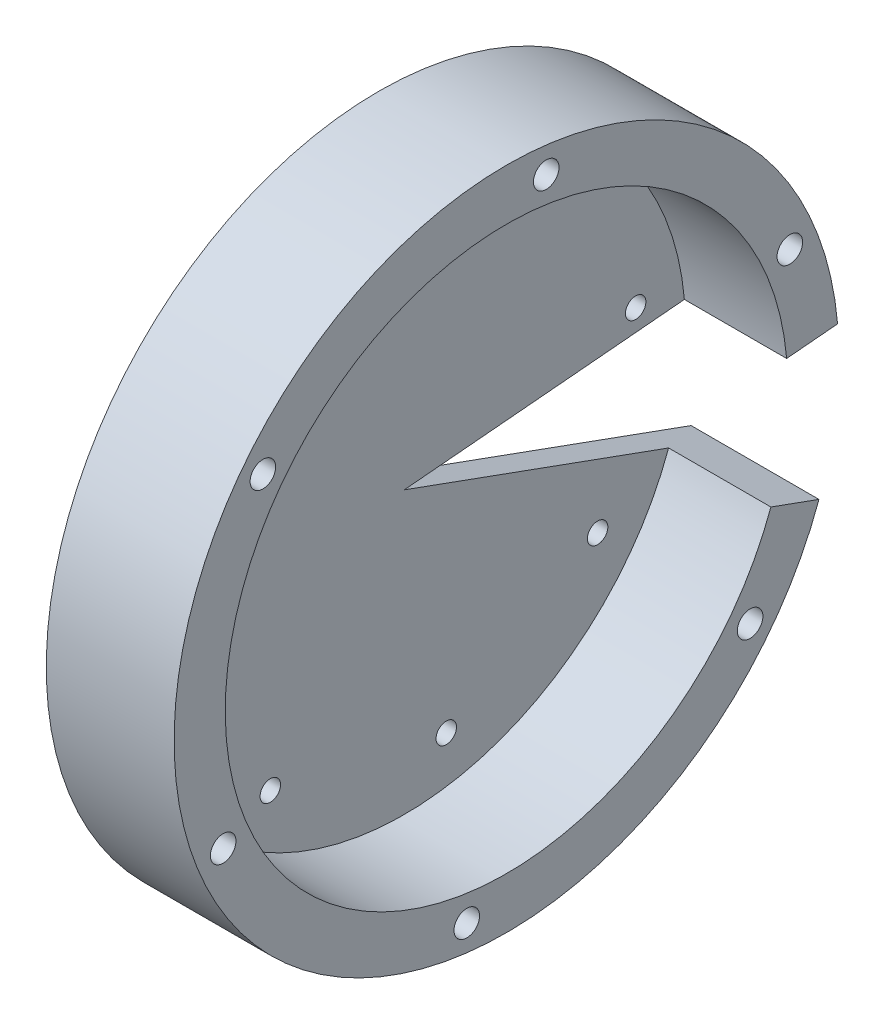
from build123d import *

# Parameters (mm, degrees)
SKETCH_1_R          = 55
EXTRUDE_1_DEPTH     = 5
SKETCH_2_R          = 65
SKETCH_2_R_2        = 60
SKETCH_2_R_3        = 55
EXTRUDE_2_DEPTH     = 25
SKETCH_3_R          = 2.5
CUT_EXTRUDE_1_DEPTH = 96.262794416
SKETCH_4_R          = 4
SKETCH_4_R_2        = 2.5
CUT_EXTRUDE_2_DEPTH = 10
CUT_EXTRUDE_3_REACH = 97.263
SKETCH_5_R          = 2
SKETCH_6_R          = 2.5
CUT_EXTRUDE_4_DEPTH = 2
CUT_EXTRUDE_5_DEPTH = 96.262794416


with BuildPart() as part:
    # 草图1 → 凸台-拉伸1 (new body)
    with BuildSketch(Plane(origin=(0, 0, 0), x_dir=(0, 0, -1), z_dir=(1, 0, 0))):
        Circle(SKETCH_1_R)
    extrude(amount=EXTRUDE_1_DEPTH)

    # 草图2 → 凸台-拉伸2 (add)
    # profile 1 of 2: a face of its own
    with BuildSketch(Plane.ZY):
        Circle(SKETCH_2_R)
        Circle(SKETCH_2_R_2, mode=Mode.SUBTRACT)
    # profile 2 of 2: a face of its own
    with BuildSketch(Plane.ZY):
        Circle(SKETCH_2_R_2)
        Circle(SKETCH_2_R_3, mode=Mode.SUBTRACT)
    extrude(amount=-EXTRUDE_2_DEPTH)

    # 草图3 → 切除-拉伸1 (cut, through all)
    with BuildSketch(Plane.ZY):
        with Locations((-7.767898365, 59.495039751)):
            Circle(SKETCH_3_R)
        with Locations((47.640266641, 36.474717194)):
            Circle(SKETCH_3_R)
        with Locations((55.408165006, -23.020322557)):
            Circle(SKETCH_3_R)
        with Locations((7.767898365, -59.495039751)):
            Circle(SKETCH_3_R)
        with Locations((-47.640266641, -36.474717194)):
            Circle(SKETCH_3_R)
        with Locations((-55.408165006, 23.020322557)):
            Circle(SKETCH_3_R)
    extrude(amount=-CUT_EXTRUDE_1_DEPTH, mode=Mode.SUBTRACT)

    # 草图4 → 切除-拉伸2 (cut)
    # profile 1 of 6: a face of its own
    with BuildSketch(Plane.ZY):
        with Locations((55.408165006, -23.020322557)):
            Circle(SKETCH_4_R)
        with Locations((55.408165006, -23.020322557)):
            Circle(SKETCH_4_R_2, mode=Mode.SUBTRACT)
    # profile 2 of 6: a face of its own
    with BuildSketch(Plane.ZY):
        with Locations((47.640266641, 36.474717194)):
            Circle(SKETCH_4_R)
        with Locations((47.640266641, 36.474717194)):
            Circle(SKETCH_4_R_2, mode=Mode.SUBTRACT)
    # profile 3 of 6: a face of its own
    with BuildSketch(Plane.ZY):
        with Locations((-7.767898365, 59.495039751)):
            Circle(SKETCH_4_R)
        with Locations((-7.767898365, 59.495039751)):
            Circle(SKETCH_4_R_2, mode=Mode.SUBTRACT)
    # profile 4 of 6: a face of its own
    with BuildSketch(Plane.ZY):
        with Locations((-55.408165006, 23.020322557)):
            Circle(SKETCH_4_R)
        with Locations((-55.408165006, 23.020322557)):
            Circle(SKETCH_4_R_2, mode=Mode.SUBTRACT)
    # profile 5 of 6: a face of its own
    with BuildSketch(Plane.ZY):
        with Locations((-47.640266641, -36.474717194)):
            Circle(SKETCH_4_R)
        with Locations((-47.640266641, -36.474717194)):
            Circle(SKETCH_4_R_2, mode=Mode.SUBTRACT)
    # profile 6 of 6: a face of its own
    with BuildSketch(Plane.ZY):
        with Locations((7.767898365, -59.495039751)):
            Circle(SKETCH_4_R)
    extrude(amount=-CUT_EXTRUDE_2_DEPTH, mode=Mode.SUBTRACT)

    # 草图5 → 切除-拉伸3 (cut, up to next)
    with BuildSketch(Plane.ZY, mode=Mode.PRIVATE) as cut_extrude_3_sk1:
        with Locations((-26.187421569, 37.818235702)):
            Circle(SKETCH_5_R)
    cut_extrude_3_tool1 = extrude(cut_extrude_3_sk1.sketch, amount=-CUT_EXTRUDE_3_REACH, mode=Mode.PRIVATE) & part.part
    # 草图5 → 切除-拉伸3 (cut, up to next)
    with BuildSketch(Plane.ZY, mode=Mode.PRIVATE) as cut_extrude_3_sk2:
        with Locations((8.224227544, 45.25883429)):
            Circle(SKETCH_5_R)
    cut_extrude_3_tool2 = extrude(cut_extrude_3_sk2.sketch, amount=-CUT_EXTRUDE_3_REACH, mode=Mode.PRIVATE) & part.part
    # 草图5 → 切除-拉伸3 (cut, up to next)
    with BuildSketch(Plane.ZY, mode=Mode.PRIVATE) as cut_extrude_3_sk3:
        with Locations((37.818235702, 26.187421569)):
            Circle(SKETCH_5_R)
    cut_extrude_3_tool3 = extrude(cut_extrude_3_sk3.sketch, amount=-CUT_EXTRUDE_3_REACH, mode=Mode.PRIVATE) & part.part
    # 草图5 → 切除-拉伸3 (cut, up to next)
    with BuildSketch(Plane.ZY, mode=Mode.PRIVATE) as cut_extrude_3_sk4:
        with Locations((45.25883429, -8.224227544)):
            Circle(SKETCH_5_R)
    cut_extrude_3_tool4 = extrude(cut_extrude_3_sk4.sketch, amount=-CUT_EXTRUDE_3_REACH, mode=Mode.PRIVATE) & part.part
    # 草图5 → 切除-拉伸3 (cut, up to next)
    with BuildSketch(Plane.ZY, mode=Mode.PRIVATE) as cut_extrude_3_sk5:
        with Locations((26.187421569, -37.818235702)):
            Circle(SKETCH_5_R)
    cut_extrude_3_tool5 = extrude(cut_extrude_3_sk5.sketch, amount=-CUT_EXTRUDE_3_REACH, mode=Mode.PRIVATE) & part.part
    # 草图5 → 切除-拉伸3 (cut, up to next)
    with BuildSketch(Plane.ZY, mode=Mode.PRIVATE) as cut_extrude_3_sk6:
        with Locations((-8.224227544, -45.25883429)):
            Circle(SKETCH_5_R)
    cut_extrude_3_tool6 = extrude(cut_extrude_3_sk6.sketch, amount=-CUT_EXTRUDE_3_REACH, mode=Mode.PRIVATE) & part.part
    # 草图5 → 切除-拉伸3 (cut, up to next)
    with BuildSketch(Plane.ZY, mode=Mode.PRIVATE) as cut_extrude_3_sk7:
        with Locations((-37.818235702, -26.187421569)):
            Circle(SKETCH_5_R)
    cut_extrude_3_tool7 = extrude(cut_extrude_3_sk7.sketch, amount=-CUT_EXTRUDE_3_REACH, mode=Mode.PRIVATE) & part.part
    # 草图5 → 切除-拉伸3 (cut, up to next)
    with BuildSketch(Plane.ZY, mode=Mode.PRIVATE) as cut_extrude_3_sk8:
        with Locations((-45.25883429, 8.224227544)):
            Circle(SKETCH_5_R)
    cut_extrude_3_tool8 = extrude(cut_extrude_3_sk8.sketch, amount=-CUT_EXTRUDE_3_REACH, mode=Mode.PRIVATE) & part.part
    add(cut_extrude_3_tool1.solids().sort_by_distance((0, 37.818236, -26.187422))[0], mode=Mode.SUBTRACT)
    add(cut_extrude_3_tool2.solids().sort_by_distance((0, 45.258834, 8.224228))[0], mode=Mode.SUBTRACT)
    add(cut_extrude_3_tool3.solids().sort_by_distance((0, 26.187422, 37.818236))[0], mode=Mode.SUBTRACT)
    add(cut_extrude_3_tool4.solids().sort_by_distance((0, -8.224228, 45.258834))[0], mode=Mode.SUBTRACT)
    add(cut_extrude_3_tool5.solids().sort_by_distance((0, -37.818236, 26.187422))[0], mode=Mode.SUBTRACT)
    add(cut_extrude_3_tool6.solids().sort_by_distance((0, -45.258834, -8.224228))[0], mode=Mode.SUBTRACT)
    add(cut_extrude_3_tool7.solids().sort_by_distance((0, -26.187422, -37.818236))[0], mode=Mode.SUBTRACT)
    add(cut_extrude_3_tool8.solids().sort_by_distance((0, 8.224228, -45.258834))[0], mode=Mode.SUBTRACT)

    # 草图6 → 切除-拉伸4 (cut)
    with BuildSketch(Plane.ZY):
        with Locations((8.224227544, 45.25883429)):
            Circle(SKETCH_6_R)
        with Locations((37.818235702, 26.187421569)):
            Circle(SKETCH_6_R)
        with Locations((45.25883429, -8.224227544)):
            Circle(SKETCH_6_R)
        with Locations((26.187421569, -37.818235702)):
            Circle(SKETCH_6_R)
        with Locations((-8.224227544, -45.25883429)):
            Circle(SKETCH_6_R)
        with Locations((-37.818235702, -26.187421569)):
            Circle(SKETCH_6_R)
        with Locations((-45.25883429, 8.224227544)):
            Circle(SKETCH_6_R)
        with Locations((-26.187421569, 37.818235702)):
            Circle(SKETCH_6_R)
    extrude(amount=-CUT_EXTRUDE_4_DEPTH, mode=Mode.SUBTRACT)

    # 草图8 → 切除-拉伸5 (cut, through all)
    with BuildSketch(Plane.ZY):
        with BuildLine():
            Line((-61.103779565, -22.165922559), (-64.746554899, 5.734424884))
            ThreePointArc((-64.746554899, 5.734424884), (-64.45295973, -8.415223229), (-61.103779565, -22.165922559))
        make_face()
        Polygon((-64.746554899, 5.734424884), (-61.103779565, -22.165922559), (0, 0), align=None)
    extrude(amount=-CUT_EXTRUDE_5_DEPTH, mode=Mode.SUBTRACT)


solid = part.part
